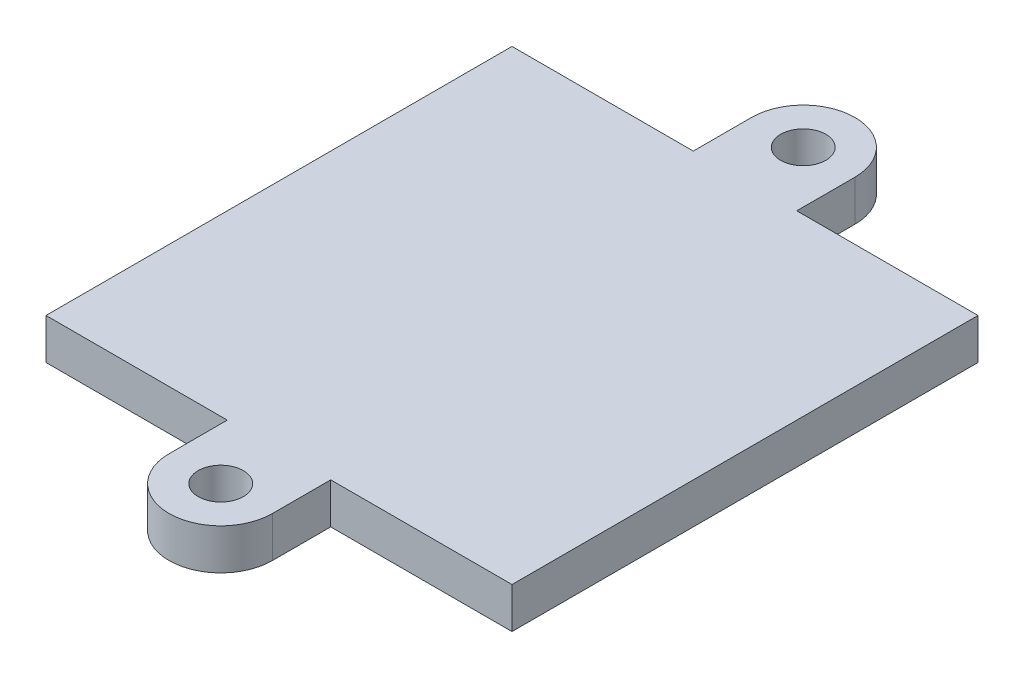
from build123d import *

# Parameters (mm, degrees)
SKETCH1_R           = 2.4638
BOSS_EXTRUDE1_DEPTH = 4.445


with BuildPart() as part:
    # Sketch1 → Boss-Extrude1 (new body)
    with BuildSketch(Plane(origin=(0, 0, 0), x_dir=(1, 0, 0), z_dir=(0, 1, 0))):
        with BuildLine():
            ThreePointArc((5.6388, -31.75), (0, -37.3888), (-5.6388, -31.75))
            Line((-5.6388, -31.75), (-5.6388, -25.4))
            Line((-5.6388, -25.4), (-25.4, -25.4))
            Line((-25.4, -25.4), (-25.4, 25.4))
            Line((-25.4, 25.4), (-5.6388, 25.4))
            Line((-5.6388, 25.4), (-5.6388, 31.75))
            ThreePointArc((-5.6388, 31.75), (0, 37.3888), (5.6388, 31.75))
            Line((5.6388, 31.75), (5.6388, 25.4))
            Line((5.6388, 25.4), (25.4, 25.4))
            Line((25.4, 25.4), (25.4, -25.4))
            Line((25.4, -25.4), (5.6388, -25.4))
            Line((5.6388, -25.4), (5.6388, -31.75))
        make_face()
        with Locations(Location((0, 31.75, 0), (0, 0, 270))):
            Circle(SKETCH1_R, mode=Mode.SUBTRACT)
        with Locations(Location((0, -31.75, 0), (0, 0, 270))):
            Circle(SKETCH1_R, mode=Mode.SUBTRACT)
    extrude(amount=BOSS_EXTRUDE1_DEPTH)


solid = part.part
